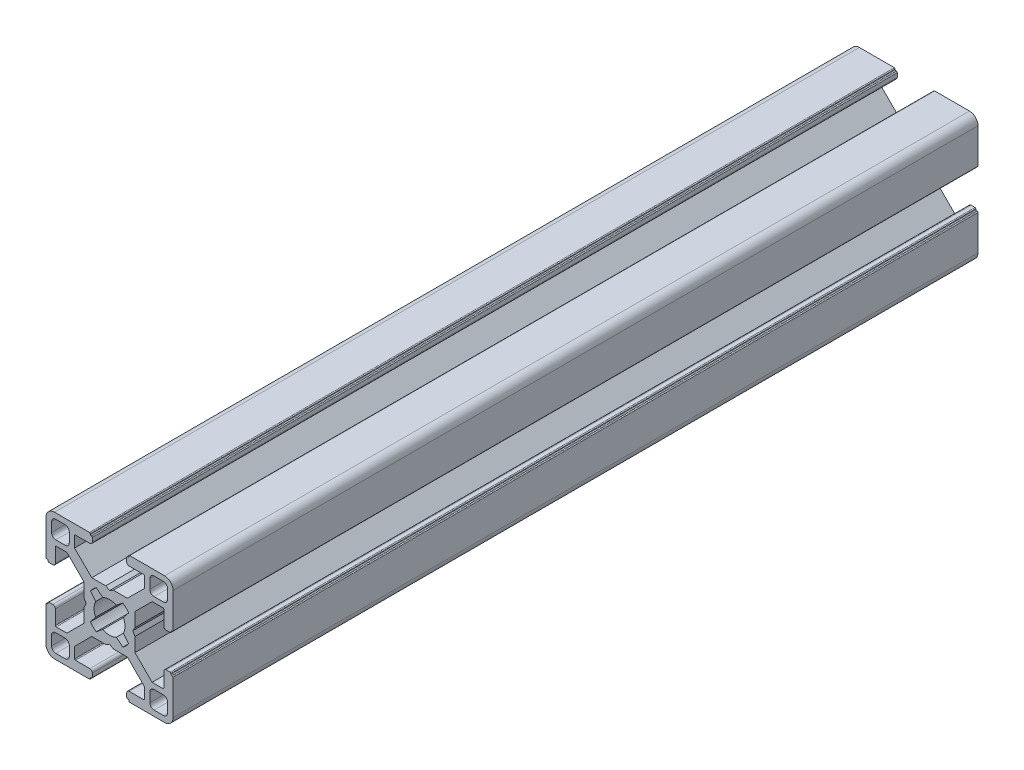
from build123d import *

# Parameters (mm, degrees)
BASE_EXTRUDE_DEPTH = 190


with BuildPart() as part:
    # Sketch1 → Base-Extrude (new body)
    with BuildSketch(Plane.XY):
        with BuildLine():
            Line((6.00446543, 0.899999619), (5.484852164, 0))
            Line((5.484852164, 0), (6.00446543, -0.899999619))
            Line((6.00446543, -0.899999619), (6.00446543, -4.204465866))
            Line((6.00446543, -4.204465866), (10.049999564, -8.25))
            Line((10.049999564, -8.25), (12.59999928, -8.25))
            ThreePointArc((12.59999928, -8.25), (12.741420837, -8.191421273), (12.799999564, -8.049999716))
            Line((12.799999564, -8.049999716), (12.799999564, -4.649999613))
            ThreePointArc((12.799999564, -4.649999613), (12.975735606, -4.225735278), (13.39999994, -4.049999237))
            Line((13.39999994, -4.049999237), (14.300000043, -4.049999237))
            ThreePointArc((14.300000043, -4.049999237), (14.4414216, -4.108577964), (14.500000327, -4.249999521))
            Line((14.500000327, -4.249999521), (14.500000327, -4.349998953))
            ThreePointArc((14.500000327, -4.349998953), (14.558579054, -4.49142051), (14.700000611, -4.549999237))
            Line((14.700000611, -4.549999237), (14.799999716, -4.549999237))
            ThreePointArc((14.799999716, -4.549999237), (14.941421273, -4.608577964), (15, -4.749999521))
            Line((15, -4.749999521), (15, -13.000000346))
            ThreePointArc((15, -13.000000346), (14.414213664, -14.414213664), (13.000000346, -15))
            Line((13.000000346, -15), (4.749999945, -15))
            ThreePointArc((4.749999945, -15), (4.60857832, -14.941421245), (4.549999564, -14.799999619))
            Line((4.549999564, -14.799999619), (4.549999564, -14.69999942))
            ThreePointArc((4.549999564, -14.69999942), (4.49142109, -14.558578474), (4.350000144, -14.5))
            Line((4.350000144, -14.5), (4.250000374, -14.5))
            ThreePointArc((4.250000374, -14.5), (4.108578753, -14.441421247), (4.05, -14.299999626))
            Line((4.05, -14.299999626), (4.05, -13.399999434))
            ThreePointArc((4.05, -13.399999434), (4.225735989, -12.975735226), (4.650000197, -12.799999237))
            Line((4.650000197, -12.799999237), (8.049999924, -12.799999237))
            ThreePointArc((8.049999924, -12.799999237), (8.191421565, -12.741420475), (8.250000327, -12.599998834))
            Line((8.250000327, -12.599998834), (8.250000327, -10.049999237))
            Line((8.250000327, -10.049999237), (4.204466193, -6))
            Line((4.204466193, -6), (0.899999946, -6))
            Line((0.899999946, -6), (0, -5.484851837))
            Line((0, -5.484851837), (-0.899999946, -6))
            Line((-0.899999946, -6), (-4.204466193, -6))
            Line((-4.204466193, -6), (-8.250000327, -10.049999237))
            Line((-8.250000327, -10.049999237), (-8.250000327, -12.599998834))
            ThreePointArc((-8.250000327, -12.599998834), (-8.191421565, -12.741420475), (-8.049999924, -12.799999237))
            Line((-8.049999924, -12.799999237), (-4.650000197, -12.799999237))
            ThreePointArc((-4.650000197, -12.799999237), (-4.225735989, -12.975735226), (-4.05, -13.399999434))
            Line((-4.05, -13.399999434), (-4.05, -14.299999626))
            ThreePointArc((-4.05, -14.299999626), (-4.108578753, -14.441421247), (-4.250000374, -14.5))
            Line((-4.250000374, -14.5), (-4.350000144, -14.5))
            ThreePointArc((-4.350000144, -14.5), (-4.49142109, -14.558578474), (-4.549999564, -14.69999942))
            Line((-4.549999564, -14.69999942), (-4.549999564, -14.799999619))
            ThreePointArc((-4.549999564, -14.799999619), (-4.60857832, -14.941421245), (-4.749999945, -15))
            Line((-4.749999945, -15), (-13.000000346, -15))
            ThreePointArc((-13.000000346, -15), (-14.414213664, -14.414213664), (-15, -13.000000346))
            Line((-15, -13.000000346), (-15, -4.749999521))
            ThreePointArc((-15, -4.749999521), (-14.941421273, -4.608577964), (-14.799999716, -4.549999237))
            Line((-14.799999716, -4.549999237), (-14.700000611, -4.549999237))
            ThreePointArc((-14.700000611, -4.549999237), (-14.558579054, -4.49142051), (-14.500000327, -4.349998953))
            Line((-14.500000327, -4.349998953), (-14.500000327, -4.249999521))
            ThreePointArc((-14.500000327, -4.249999521), (-14.4414216, -4.108577964), (-14.300000043, -4.049999237))
            Line((-14.300000043, -4.049999237), (-13.39999994, -4.049999237))
            ThreePointArc((-13.39999994, -4.049999237), (-12.975735606, -4.225735278), (-12.799999564, -4.649999613))
            Line((-12.799999564, -4.649999613), (-12.799999564, -8.049999716))
            ThreePointArc((-12.799999564, -8.049999716), (-12.741420837, -8.191421273), (-12.59999928, -8.25))
            Line((-12.59999928, -8.25), (-10.049999564, -8.25))
            Line((-10.049999564, -8.25), (-6.00446543, -4.204465866))
            Line((-6.00446543, -4.204465866), (-6.00446543, -0.899999619))
            Line((-6.00446543, -0.899999619), (-5.484852164, 0))
            Line((-5.484852164, 0), (-6.00446543, 0.899999619))
            Line((-6.00446543, 0.899999619), (-6.00446543, 4.204465866))
            Line((-6.00446543, 4.204465866), (-10.049999564, 8.25))
            Line((-10.049999564, 8.25), (-12.59999928, 8.25))
            ThreePointArc((-12.59999928, 8.25), (-12.741420837, 8.191421273), (-12.799999564, 8.049999716))
            Line((-12.799999564, 8.049999716), (-12.799999564, 4.649999613))
            ThreePointArc((-12.799999564, 4.649999613), (-12.975735606, 4.225735278), (-13.39999994, 4.049999237))
            Line((-13.39999994, 4.049999237), (-14.300000043, 4.049999237))
            ThreePointArc((-14.300000043, 4.049999237), (-14.4414216, 4.108577964), (-14.500000327, 4.249999521))
            Line((-14.500000327, 4.249999521), (-14.500000327, 4.349998953))
            ThreePointArc((-14.500000327, 4.349998953), (-14.558579054, 4.49142051), (-14.700000611, 4.549999237))
            Line((-14.700000611, 4.549999237), (-14.799999716, 4.549999237))
            ThreePointArc((-14.799999716, 4.549999237), (-14.941421273, 4.608577964), (-15, 4.749999521))
            Line((-15, 4.749999521), (-15, 13.000000346))
            ThreePointArc((-15, 13.000000346), (-14.414213664, 14.414213664), (-13.000000346, 15))
            Line((-13.000000346, 15), (-4.749999945, 15))
            ThreePointArc((-4.749999945, 15), (-4.60857832, 14.941421245), (-4.549999564, 14.799999619))
            Line((-4.549999564, 14.799999619), (-4.549999564, 14.69999942))
            ThreePointArc((-4.549999564, 14.69999942), (-4.49142109, 14.558578474), (-4.350000144, 14.5))
            Line((-4.350000144, 14.5), (-4.250000374, 14.5))
            ThreePointArc((-4.250000374, 14.5), (-4.108578753, 14.441421247), (-4.05, 14.299999626))
            Line((-4.05, 14.299999626), (-4.05, 13.399999434))
            ThreePointArc((-4.05, 13.399999434), (-4.225735989, 12.975735226), (-4.650000197, 12.799999237))
            Line((-4.650000197, 12.799999237), (-8.049999924, 12.799999237))
            ThreePointArc((-8.049999924, 12.799999237), (-8.191421565, 12.741420475), (-8.250000327, 12.599998834))
            Line((-8.250000327, 12.599998834), (-8.250000327, 10.049999237))
            Line((-8.250000327, 10.049999237), (-4.204466193, 6))
            Line((-4.204466193, 6), (-0.899999946, 6))
            Line((-0.899999946, 6), (0, 5.484851837))
            Line((0, 5.484851837), (0.899999946, 6))
            Line((0.899999946, 6), (4.204466193, 6))
            Line((4.204466193, 6), (8.250000327, 10.049999237))
            Line((8.250000327, 10.049999237), (8.250000327, 12.599998834))
            ThreePointArc((8.250000327, 12.599998834), (8.191421565, 12.741420475), (8.049999924, 12.799999237))
            Line((8.049999924, 12.799999237), (4.650000197, 12.799999237))
            ThreePointArc((4.650000197, 12.799999237), (4.225735989, 12.975735226), (4.05, 13.399999434))
            Line((4.05, 13.399999434), (4.05, 14.299999626))
            ThreePointArc((4.05, 14.299999626), (4.108578753, 14.441421247), (4.250000374, 14.5))
            Line((4.250000374, 14.5), (4.350000144, 14.5))
            ThreePointArc((4.350000144, 14.5), (4.49142109, 14.558578474), (4.549999564, 14.69999942))
            Line((4.549999564, 14.69999942), (4.549999564, 14.799999619))
            ThreePointArc((4.549999564, 14.799999619), (4.60857832, 14.941421245), (4.749999945, 15))
            Line((4.749999945, 15), (13.000000346, 15))
            ThreePointArc((13.000000346, 15), (14.414213664, 14.414213664), (15, 13.000000346))
            Line((15, 13.000000346), (15, 4.749999521))
            ThreePointArc((15, 4.749999521), (14.941421273, 4.608577964), (14.799999716, 4.549999237))
            Line((14.799999716, 4.549999237), (14.700000611, 4.549999237))
            ThreePointArc((14.700000611, 4.549999237), (14.558579054, 4.49142051), (14.500000327, 4.349998953))
            Line((14.500000327, 4.349998953), (14.500000327, 4.249999521))
            ThreePointArc((14.500000327, 4.249999521), (14.4414216, 4.108577964), (14.300000043, 4.049999237))
            Line((14.300000043, 4.049999237), (13.39999994, 4.049999237))
            ThreePointArc((13.39999994, 4.049999237), (12.975735606, 4.225735278), (12.799999564, 4.649999613))
            Line((12.799999564, 4.649999613), (12.799999564, 8.049999716))
            ThreePointArc((12.799999564, 8.049999716), (12.741420837, 8.191421273), (12.59999928, 8.25))
            Line((12.59999928, 8.25), (10.049999564, 8.25))
            Line((10.049999564, 8.25), (6.00446543, 4.204465866))
            Line((6.00446543, 4.204465866), (6.00446543, 0.899999619))
        make_face()
        with BuildLine():
            Line((13.70000109, 12.700000408), (13.70000109, 10.499999626))
            ThreePointArc((13.70000109, 10.499999626), (13.407107874, 9.792892851), (12.7000011, 9.499999635))
            Line((12.7000011, 9.499999635), (10.500000318, 9.499999635))
            ThreePointArc((10.500000318, 9.499999635), (9.792893543, 9.792892851), (9.500000327, 10.499999626))
            Line((9.500000327, 10.499999626), (9.500000327, 12.700000408))
            ThreePointArc((9.500000327, 12.700000408), (9.792893543, 13.407107182), (10.500000318, 13.700000398))
            Line((10.500000318, 13.700000398), (12.7000011, 13.700000398))
            ThreePointArc((12.7000011, 13.700000398), (13.407107874, 13.407107182), (13.70000109, 12.700000408))
        make_face(mode=Mode.SUBTRACT)
        with BuildLine():
            Line((3.135929412, 4.518400903), (1.600129524, 3.280561767))
            ThreePointArc((1.600129524, 3.280561767), (0, 3.65), (-1.600129524, 3.280561767))
            Line((-1.600129524, 3.280561767), (-3.135929412, 4.518400903))
            ThreePointArc((-3.135929412, 4.518400903), (-3.881002259, 3.897155561), (-4.505336892, 3.154669473))
            Line((-4.505336892, 3.154669473), (-3.280561732, 1.600129597))
            ThreePointArc((-3.280561732, 1.600129597), (-3.65, 0), (-3.280561732, -1.600129597))
            Line((-3.280561732, -1.600129597), (-4.505336892, -3.154669473))
            ThreePointArc((-4.505336892, -3.154669473), (-3.881002259, -3.897155561), (-3.135929412, -4.518400903))
            Line((-3.135929412, -4.518400903), (-1.600129524, -3.280561767))
            ThreePointArc((-1.600129524, -3.280561767), (0, -3.65), (1.600129524, -3.280561767))
            Line((1.600129524, -3.280561767), (3.135929412, -4.518400903))
            ThreePointArc((3.135929412, -4.518400903), (3.881002259, -3.897155561), (4.505336892, -3.154669473))
            Line((4.505336892, -3.154669473), (3.280561732, -1.600129597))
            ThreePointArc((3.280561732, -1.600129597), (3.65, 0), (3.280561732, 1.600129597))
            Line((3.280561732, 1.600129597), (4.505336892, 3.154669473))
            ThreePointArc((4.505336892, 3.154669473), (3.881002259, 3.897155561), (3.135929412, 4.518400903))
        make_face(mode=Mode.SUBTRACT)
        with BuildLine():
            Line((-13.70000109, -12.700000408), (-13.70000109, -10.499999626))
            ThreePointArc((-13.70000109, -10.499999626), (-13.407107874, -9.792892851), (-12.7000011, -9.499999635))
            Line((-12.7000011, -9.499999635), (-10.500000318, -9.499999635))
            ThreePointArc((-10.500000318, -9.499999635), (-9.792893543, -9.792892851), (-9.500000327, -10.499999626))
            Line((-9.500000327, -10.499999626), (-9.500000327, -12.700000408))
            ThreePointArc((-9.500000327, -12.700000408), (-9.792893543, -13.407107182), (-10.500000318, -13.700000398))
            Line((-10.500000318, -13.700000398), (-12.7000011, -13.700000398))
            ThreePointArc((-12.7000011, -13.700000398), (-13.407107874, -13.407107182), (-13.70000109, -12.700000408))
        make_face(mode=Mode.SUBTRACT)
        with BuildLine():
            Line((10.500000318, -13.700000398), (12.7000011, -13.700000398))
            ThreePointArc((12.7000011, -13.700000398), (13.407107874, -13.407107182), (13.70000109, -12.700000408))
            Line((13.70000109, -12.700000408), (13.70000109, -10.499999626))
            ThreePointArc((13.70000109, -10.499999626), (13.407107874, -9.792892851), (12.7000011, -9.499999635))
            Line((12.7000011, -9.499999635), (10.500000318, -9.499999635))
            ThreePointArc((10.500000318, -9.499999635), (9.792893543, -9.792892851), (9.500000327, -10.499999626))
            Line((9.500000327, -10.499999626), (9.500000327, -12.700000408))
            ThreePointArc((9.500000327, -12.700000408), (9.792893543, -13.407107182), (10.500000318, -13.700000398))
        make_face(mode=Mode.SUBTRACT)
        with BuildLine():
            Line((-10.500000318, 13.700000398), (-12.7000011, 13.700000398))
            ThreePointArc((-12.7000011, 13.700000398), (-13.407107874, 13.407107182), (-13.70000109, 12.700000408))
            Line((-13.70000109, 12.700000408), (-13.70000109, 10.499999626))
            ThreePointArc((-13.70000109, 10.499999626), (-13.407107874, 9.792892851), (-12.7000011, 9.499999635))
            Line((-12.7000011, 9.499999635), (-10.500000318, 9.499999635))
            ThreePointArc((-10.500000318, 9.499999635), (-9.792893543, 9.792892851), (-9.500000327, 10.499999626))
            Line((-9.500000327, 10.499999626), (-9.500000327, 12.700000408))
            ThreePointArc((-9.500000327, 12.700000408), (-9.792893543, 13.407107182), (-10.500000318, 13.700000398))
        make_face(mode=Mode.SUBTRACT)
    extrude(amount=-BASE_EXTRUDE_DEPTH)


solid = part.part
